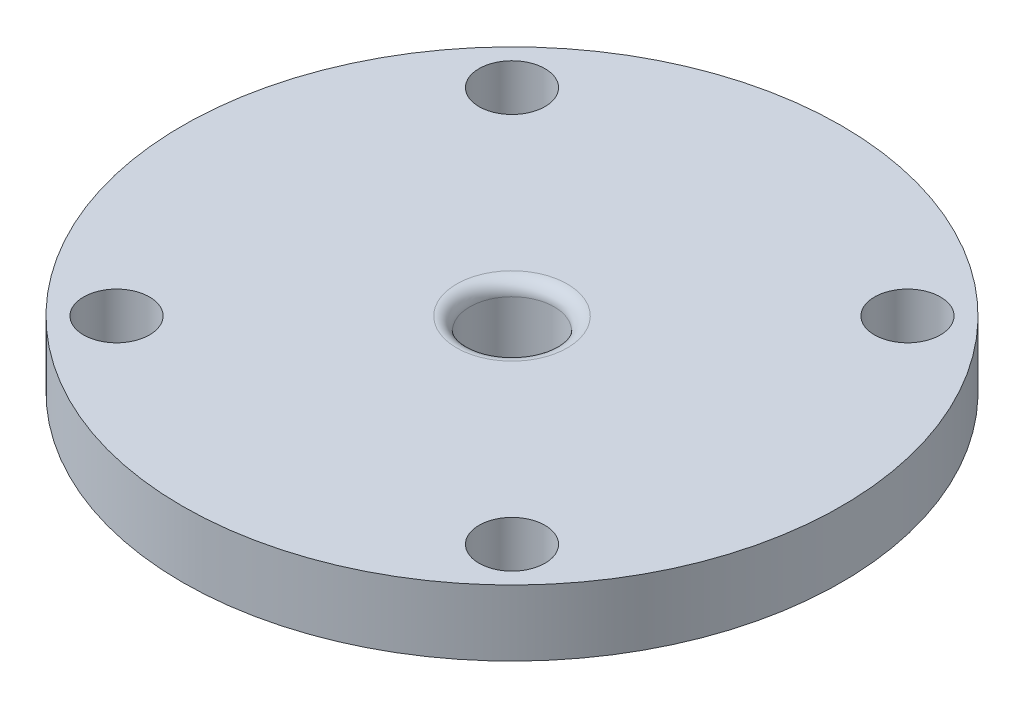
from build123d import *

# Parameters (mm, degrees)
SKETCH1_R           = 25
BOSS_EXTRUDE1_DEPTH = 5
SKETCH2_R           = 2.5
CUT_EXTRUDE1_DEPTH  = 36.707142143
SKETCH3_R           = 3.2
CUT_EXTRUDE2_DEPTH  = 36.707142143
FILLET1_R           = 1


with BuildPart() as part:
    # Sketch1 → Boss-Extrude1 (new body)
    with BuildSketch(Plane(origin=(0, 0, 0), x_dir=(1, 0, 0), z_dir=(0, 1, 0))):
        with Locations(Location((0, 0, 0), (0, 0, 270))):
            Circle(SKETCH1_R)
    extrude(amount=BOSS_EXTRUDE1_DEPTH)

    # Sketch2 → Cut-Extrude1 (cut, through all)
    with BuildSketch(Plane(origin=(0, 5, 0), x_dir=(1, 0, 0), z_dir=(0, 1, 0))):
        with Locations(Location((-15, 15, 0), (0, 0, 270))):
            Circle(SKETCH2_R)
        with Locations(Location((15, 15, 0), (0, 0, 270))):
            Circle(SKETCH2_R)
        with Locations(Location((15, -15, 0), (0, 0, 270))):
            Circle(SKETCH2_R)
        with Locations(Location((-15, -15, 0), (0, 0, 270))):
            Circle(SKETCH2_R)
    extrude(amount=-CUT_EXTRUDE1_DEPTH, mode=Mode.SUBTRACT)

    # Sketch3 → Cut-Extrude2 (cut, through all)
    with BuildSketch(Plane(origin=(0, 5, 0), x_dir=(1, 0, 0), z_dir=(0, 1, 0))):
        with Locations(Location((0, 0, 0), (0, 0, 270))):
            Circle(SKETCH3_R)
    extrude(amount=-CUT_EXTRUDE2_DEPTH, mode=Mode.SUBTRACT)

    # Fillet1
    fillet1_edges = [part.edges().sort_by_distance(p)[0] for p in [
        (0, 5, -3.2),
    ]]
    fillet(fillet1_edges, radius=FILLET1_R)


solid = part.part
